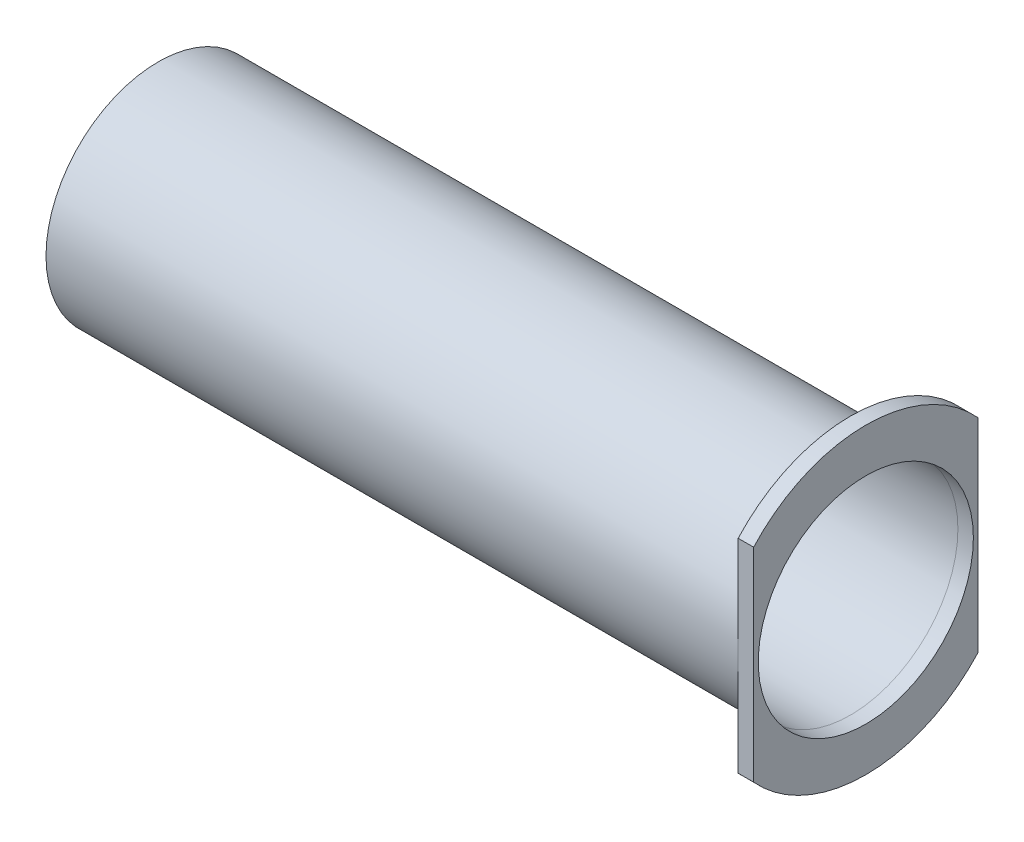
from build123d import *

# Parameters (mm, degrees)
CUT_EXTRUDE1_DEPTH      = 45
CUT_EXTRUDE1_DEPTH_BACK = 260
SKETCH2_R               = 3.825
SKETCH3_R               = 23.31
CUT_EXTRUDE2_DEPTH      = 149
SKETCH4_R               = 24.31
SKETCH4_R_2             = 23.31
BOSS_EXTRUDE1_DEPTH     = 3.35


with BuildPart() as part:
    # Sketch1 → Revolve2 (revolve)
    with BuildSketch(Plane.XY, mode=Mode.PRIVATE) as revolve2_sk:
        Polygon((-73.894736842, 0), (76.105263158, 0), (76.105263158, 24.31), (-73.894736842, 24.31), (-73.894736842, 4.825), (-78.894736842, 4.825), (-78.894736842, 0), align=None)
    revolve(revolve2_sk.sketch.rotate(Axis((-73.894736842, 0, 0), (1, 0, 0)), 90), axis=Axis((-73.894736842, 0, 0), (1, 0, 0)))

    # Sketch2 → Cut-Extrude1 (cut, two sides: drawn at the far end of the back side and taken through both)
    with BuildSketch(Plane.ZY.offset(78.894736842).offset(-CUT_EXTRUDE1_DEPTH_BACK)):
        with Locations(Location((0, 0, 0), (0, 0, 180))):
            Circle(SKETCH2_R)
    extrude(amount=CUT_EXTRUDE1_DEPTH + CUT_EXTRUDE1_DEPTH_BACK, mode=Mode.SUBTRACT)

    # Sketch3 → Cut-Extrude2 (cut)
    with BuildSketch(Plane(origin=(76.105263158, 0, 0), x_dir=(0, 0, -1), z_dir=(1, 0, 0))):
        Circle(SKETCH3_R)
    extrude(amount=-CUT_EXTRUDE2_DEPTH, mode=Mode.SUBTRACT)


with BuildPart() as body_2:
    # Sketch4 → Boss-Extrude1 (new body)
    # profile 1 of 4: a face of its own
    with BuildSketch(Plane(origin=(76.105263158, 0, 0), x_dir=(0, 0, -1), z_dir=(1, 0, 0))):
        with BuildLine():
            ThreePointArc((-24.31, 0), (0, 24.31), (24.31, 0))
            Line((24.31, 0), (24.31, 22.049405888))
            ThreePointArc((24.31, 22.049405888), (0, 32.82), (-24.31, 22.049405888))
            Line((-24.31, 22.049405888), (-24.31, 0))
        make_face()
    # profile 2 of 4: a face of its own
    with BuildSketch(Plane(origin=(76.105263158, 0, 0), x_dir=(0, 0, -1), z_dir=(1, 0, 0))):
        with BuildLine():
            ThreePointArc((-24.31, 0), (0, 24.31), (24.31, 0))
            Line((24.31, 0), (24.31, 22.049405888))
            ThreePointArc((24.31, 22.049405888), (0, 32.82), (-24.31, 22.049405888))
            Line((-24.31, 22.049405888), (-24.31, 0))
        make_face()
    # profile 3 of 4: a face of its own
    with BuildSketch(Plane(origin=(76.105263158, 0, 0), x_dir=(0, 0, -1), z_dir=(1, 0, 0))):
        with BuildLine():
            Line((24.31, -22.049405888), (24.31, 0))
            ThreePointArc((24.31, 0), (0, -24.31), (-24.31, 0))
            Line((-24.31, 0), (-24.31, -22.049405888))
            ThreePointArc((-24.31, -22.049405888), (0, -32.82), (24.31, -22.049405888))
        make_face()
    # profile 4 of 4: a face of its own
    with BuildSketch(Plane(origin=(76.105263158, 0, 0), x_dir=(0, 0, -1), z_dir=(1, 0, 0))):
        with Locations(Location((0, 0, 0), (0, 0, 180))):
            Circle(SKETCH4_R)
        Circle(SKETCH4_R_2, mode=Mode.SUBTRACT)
    extrude(amount=BOSS_EXTRUDE1_DEPTH)


solid = Compound([part.part, body_2.part])
